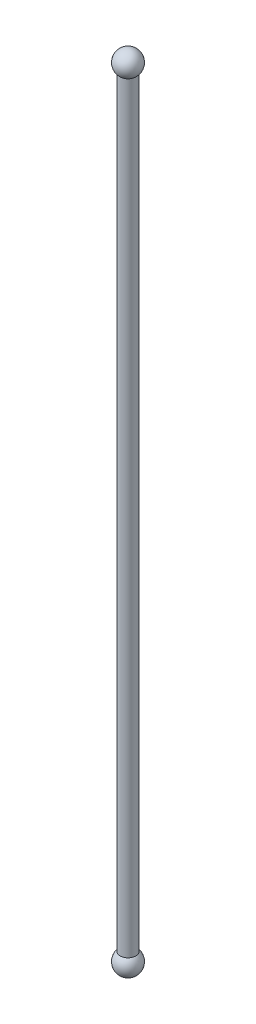
from build123d import *

# Parameters (mm, degrees)
SKETCH_2_R      = 5
EXTRUDE_1_DEPTH = 250


with BuildPart() as part:
    # 草图2 → 凸台-拉伸1 (new, symmetric)
    with BuildSketch(Plane(origin=(0, 0, 0), x_dir=(1, 0, 0), z_dir=(0, 1, 0))):
        with Locations(Location((0, 0, 0), (0, 0, 270))):
            Circle(SKETCH_2_R)
    extrude(amount=EXTRUDE_1_DEPTH, both=True)

    # 草图3 → 旋转1 (revolve)
    with BuildSketch(Plane.XY):
        with BuildLine():
            Line((0, 257.5), (0, 242.5))
            ThreePointArc((0, 242.5), (7.5, 250), (0, 257.5))
        make_face()
    revolve_1 = revolve(axis=Axis((0, 257.5, 0), (0, -1, 0)))

    # 镜向1: 旋转1 across plane
    add(revolve_1.mirror(Plane.ZX))


solid = part.part
